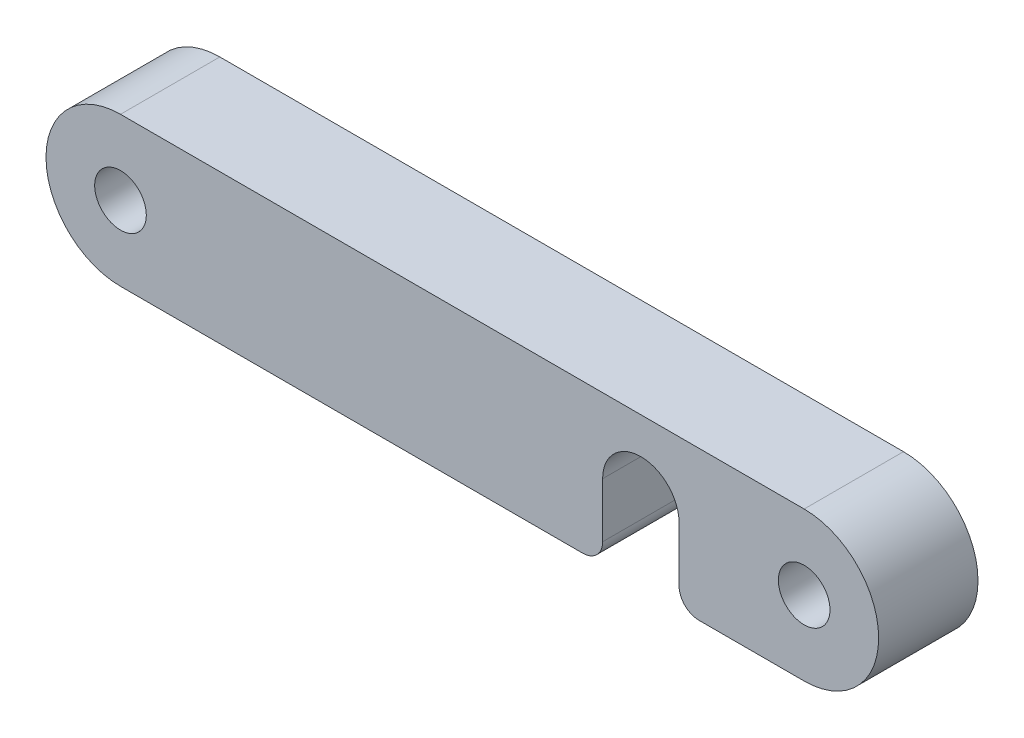
from build123d import *

# Parameters (mm, degrees)
SKETCH1_R           = 1.65
BOSS_EXTRUDE1_DEPTH = 6.35
CUT_EXTRUDE3_DEPTH  = 28.772450308


with BuildPart() as part:
    # Sketch1 → Boss-Extrude1 (new body)
    with BuildSketch(Plane.XY):
        with BuildLine():
            Line((-21.851501763, 4.7625), (21.851501763, 4.7625))
            ThreePointArc((21.851501763, 4.7625), (26.614001763, 0), (21.851501763, -4.7625))
            Line((21.851501763, -4.7625), (-21.851501763, -4.7625))
            ThreePointArc((-21.851501763, -4.7625), (-26.614001763, 0), (-21.851501763, 4.7625))
        make_face()
        with Locations((21.851501763, 0)):
            Circle(SKETCH1_R, mode=Mode.SUBTRACT)
        with Locations((-21.851501763, 0)):
            Circle(SKETCH1_R, mode=Mode.SUBTRACT)
    extrude(amount=BOSS_EXTRUDE1_DEPTH)

    # Sketch4 → Cut-Extrude3 (cut, through all)
    with BuildSketch(Plane(origin=(0, 0, 0), x_dir=(-1, 0, 0), z_dir=(0, 0, -1))):
        with BuildLine():
            Line((-8.969452091, 0), (-8.969452091, -3.4925))
            ThreePointArc((-8.969452091, -3.4925), (-8.597477703, -4.390525612), (-7.699452091, -4.7625))
            Line((-7.699452091, -4.7625), (-15.126952091, -4.7625))
            ThreePointArc((-15.126952091, -4.7625), (-14.228926479, -4.390525612), (-13.856952091, -3.4925))
            Line((-13.856952091, -3.4925), (-13.856952091, 0))
            ThreePointArc((-13.856952091, 0), (-11.413202091, 2.44375), (-8.969452091, 0))
        make_face()
    extrude(amount=-CUT_EXTRUDE3_DEPTH, mode=Mode.SUBTRACT)


solid = part.part
